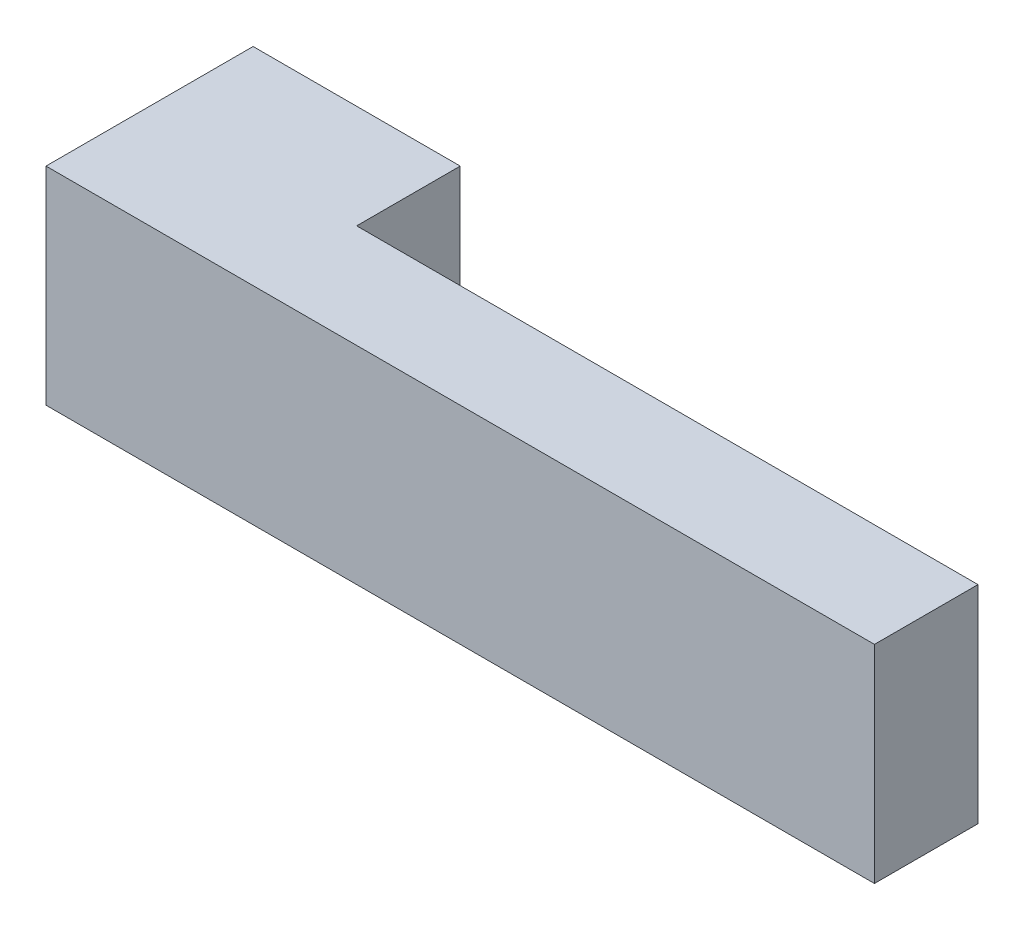
from build123d import *

# Parameters (mm, degrees)
BOSS_EXTRUDE1_DEPTH = 20


with BuildPart() as part:
    # Sketch2 → Boss-Extrude1 (new body)
    with BuildSketch(Plane(origin=(0, 0, 0), x_dir=(1, 0, 0), z_dir=(0, 1, 0))):
        Polygon((0, -20), (0, 0), (20, 0), (20, -10), (80, -10), (80, -20), align=None)
    extrude(amount=BOSS_EXTRUDE1_DEPTH)


solid = part.part
